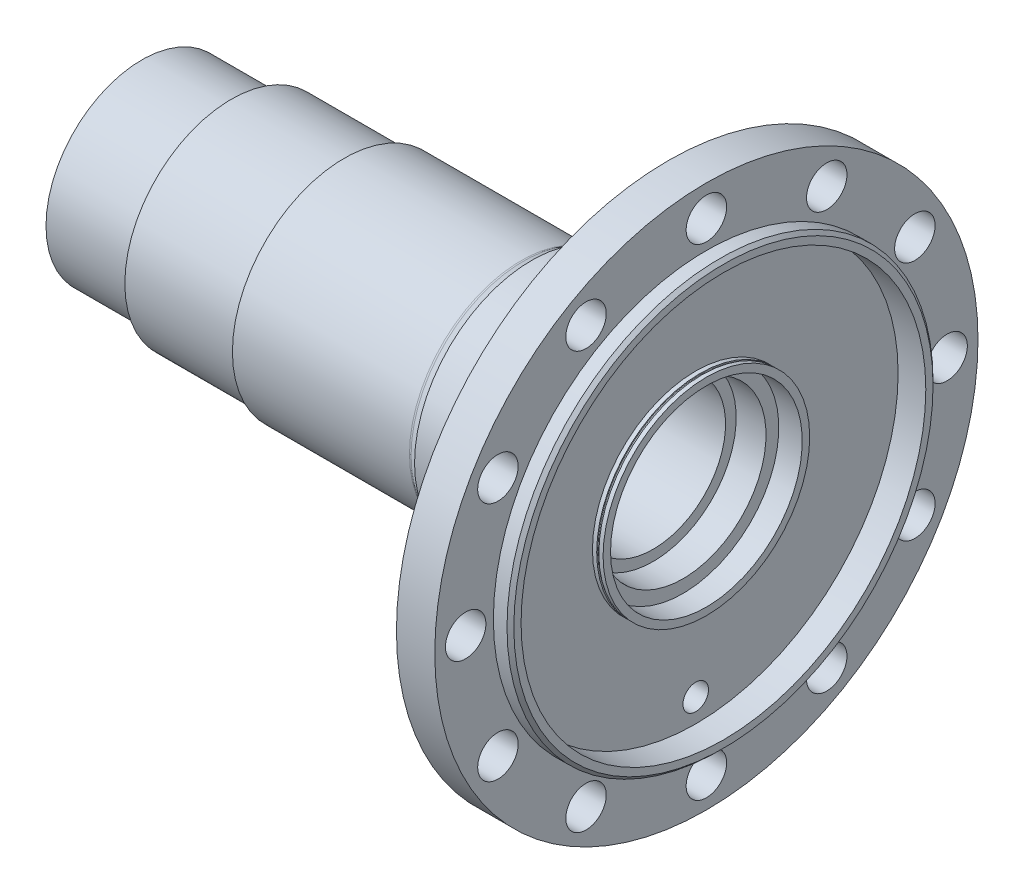
from build123d import *

# Parameters (mm, degrees)
SKETCH_3_W           = 2
SKETCH_3_H           = 46.5
SKETCH_5_W           = 2
SKETCH_5_H           = 46.5
SKETCH_6_R           = 9.5
CUT_EXTRUDE_1_DEPTH  = 328.171973127
SKETCH_7_R           = 9.5
CUT_EXTRUDE_2_DEPTH  = 328.171973127
SKETCH_8_R           = 9.5
CUT_EXTRUDE_3_DEPTH  = 328.171973127
SKETCH_9_R           = 9.5
CUT_EXTRUDE_4_DEPTH  = 328.171973127
SKETCH_10_R          = 9.5
CUT_EXTRUDE_5_DEPTH  = 328.171973127
SKETCH_11_R          = 9.5
CUT_EXTRUDE_6_DEPTH  = 328.171973127
SKETCH_12_R          = 9.5
CUT_EXTRUDE_7_DEPTH  = 328.171973127
SKETCH_13_R          = 9.5
CUT_EXTRUDE_8_DEPTH  = 328.171973127
SKETCH_14_R          = 9.5
CUT_EXTRUDE_9_DEPTH  = 328.171973127
SKETCH_15_R          = 9.5
CUT_EXTRUDE_10_DEPTH = 328.171973127
SKETCH_16_R          = 9.5
CUT_EXTRUDE_11_DEPTH = 328.171973127
SKETCH_17_R          = 9.5
CUT_EXTRUDE_12_DEPTH = 328.171973127
SKETCH_18_R          = 6
CUT_EXTRUDE_13_DEPTH = 328.171973127


with BuildPart() as part:
    # Эскиз1 → Повернуть1 (revolve)
    with BuildSketch(Plane.XY, mode=Mode.PRIVATE) as revolve_1_sk:
        with BuildLine():
            Line((0, 0), (273, 0))
            Line((273, 0), (273, 98.4))
            Line((273, 98.4), (271.4, 100))
            Line((271.4, 100), (265, 100))
            Line((265, 100), (265, 127.5))
            Line((265, 127.5), (247, 127.5))
            Line((247, 127.5), (247, 100))
            Line((247, 100), (239, 100))
            Line((239, 100), (239, 64.5))
            ThreePointArc((239, 64.5), (238.414213562, 63.085786438), (237, 62.5))
            Line((237, 62.5), (218, 62.5))
            Line((218, 62.5), (215, 60.767949192))
            Line((215, 60.767949192), (215, 57))
            ThreePointArc((215, 57), (214.414213562, 55.585786438), (213, 55))
            Line((213, 55), (183, 55))
            Line((183, 55), (179.133974596, 52.767949192))
            ThreePointArc((179.133974596, 52.767949192), (178.651612686, 52.568148347), (178.133974596, 52.5))
            Line((178.133974596, 52.5), (95, 52.5))
            Line((95, 52.5), (95, 50))
            Line((95, 50), (42, 50))
            Line((42, 50), (42, 45))
            Line((42, 45), (0, 45))
            Line((0, 45), (0, 0))
        make_face()
    revolve(revolve_1_sk.sketch.rotate(Axis((0, 0, 0), (1, 0, 0)), 90), axis=Axis((0, 0, 0), (1, 0, 0)))

    # Эскиз2 → Вырез-Повернуть1 (revolve, cut)
    with BuildSketch(Plane.XY, mode=Mode.PRIVATE) as cut_revolve_1_sk:
        Polygon((0, 0), (273, 0), (273, 95), (265, 95), (265, 45), (254, 45), (254, 39), (240, 39), (240, 34), (203.5, 34), (203.5, 31), (0, 31), align=None)
    revolve(cut_revolve_1_sk.sketch.rotate(Axis((0, 0, 0), (1, 0, 0)), 90), axis=Axis((0, 0, 0), (1, 0, 0)), mode=Mode.SUBTRACT)

    # Эскиз3 → Rear_recess_left (revolve, cut)
    with BuildSketch(Plane.XY, mode=Mode.PRIVATE) as rear_recess_left_sk:
        with Locations((261, 71.75)):
            Rectangle(SKETCH_3_W, SKETCH_3_H)
    revolve(rear_recess_left_sk.sketch.rotate(Axis((0, 0, 0), (1, 0, 0)), 90), axis=Axis((0, 0, 0), (1, 0, 0)), mode=Mode.SUBTRACT)

    # Эскиз4 → Collar_groove_nominal (revolve, cut)
    with BuildSketch(Plane.XY, mode=Mode.PRIVATE) as collar_groove_nominal_sk:
        with BuildLine():
            Line((263, 48), (263, 95))
            Line((263, 95), (262, 95))
            Line((262, 95), (262, 48))
            ThreePointArc((262, 48), (262.146446609, 47.646446609), (262.5, 47.5))
            ThreePointArc((262.5, 47.5), (262.853553391, 47.646446609), (263, 48))
        make_face()
    revolve(collar_groove_nominal_sk.sketch.rotate(Axis((0, 0, 0), (1, 0, 0)), 90), axis=Axis((0, 0, 0), (1, 0, 0)), mode=Mode.SUBTRACT)

    # Эскиз5 → Rear_recess_lip (revolve, cut)
    with BuildSketch(Plane.XY, mode=Mode.PRIVATE) as rear_recess_lip_sk:
        with Locations((264, 71.75)):
            Rectangle(SKETCH_5_W, SKETCH_5_H)
    revolve(rear_recess_lip_sk.sketch.rotate(Axis((0, 0, 0), (1, 0, 0)), 90), axis=Axis((0, 0, 0), (1, 0, 0)), mode=Mode.SUBTRACT)

    # Эскиз6 → Вырез-Вытянуть1 (cut, through all)
    with BuildSketch(Plane(origin=(0, 0, 0), x_dir=(0, 0, -1), z_dir=(1, 0, 0))):
        with Locations(Location((0, 113, 0), (0, 0, 180))):
            Circle(SKETCH_6_R)
    extrude(amount=CUT_EXTRUDE_1_DEPTH, mode=Mode.SUBTRACT)

    # Эскиз7 → Вырез-Вытянуть2 (cut, through all)
    with BuildSketch(Plane(origin=(0, 0, 0), x_dir=(0, 0, -1), z_dir=(1, 0, 0))):
        with Locations(Location((-56.5, 97.860870628, 0), (0, 0, 180))):
            Circle(SKETCH_7_R)
    extrude(amount=CUT_EXTRUDE_2_DEPTH, mode=Mode.SUBTRACT)

    # Эскиз8 → Вырез-Вытянуть3 (cut, through all)
    with BuildSketch(Plane(origin=(0, 0, 0), x_dir=(0, 0, -1), z_dir=(1, 0, 0))):
        with Locations(Location((-97.860870628, 56.5, 0), (0, 0, 180))):
            Circle(SKETCH_8_R)
    extrude(amount=CUT_EXTRUDE_3_DEPTH, mode=Mode.SUBTRACT)

    # Эскиз9 → Вырез-Вытянуть4 (cut, through all)
    with BuildSketch(Plane(origin=(0, 0, 0), x_dir=(0, 0, -1), z_dir=(1, 0, 0))):
        with Locations(Location((-113, 0, 0), (0, 0, 180))):
            Circle(SKETCH_9_R)
    extrude(amount=CUT_EXTRUDE_4_DEPTH, mode=Mode.SUBTRACT)

    # Эскиз10 → Вырез-Вытянуть5 (cut, through all)
    with BuildSketch(Plane(origin=(0, 0, 0), x_dir=(0, 0, -1), z_dir=(1, 0, 0))):
        with Locations(Location((-97.860870628, -56.5, 0), (0, 0, 180))):
            Circle(SKETCH_10_R)
    extrude(amount=CUT_EXTRUDE_5_DEPTH, mode=Mode.SUBTRACT)

    # Эскиз11 → Вырез-Вытянуть6 (cut, through all)
    with BuildSketch(Plane(origin=(0, 0, 0), x_dir=(0, 0, -1), z_dir=(1, 0, 0))):
        with Locations(Location((-56.5, -97.860870628, 0), (0, 0, 180))):
            Circle(SKETCH_11_R)
    extrude(amount=CUT_EXTRUDE_6_DEPTH, mode=Mode.SUBTRACT)

    # Эскиз12 → Вырез-Вытянуть7 (cut, through all)
    with BuildSketch(Plane(origin=(0, 0, 0), x_dir=(0, 0, -1), z_dir=(1, 0, 0))):
        with Locations(Location((0, -113, 0), (0, 0, 180))):
            Circle(SKETCH_12_R)
    extrude(amount=CUT_EXTRUDE_7_DEPTH, mode=Mode.SUBTRACT)

    # Эскиз13 → Вырез-Вытянуть8 (cut, through all)
    with BuildSketch(Plane(origin=(0, 0, 0), x_dir=(0, 0, -1), z_dir=(1, 0, 0))):
        with Locations(Location((56.5, -97.860870628, 0), (0, 0, 180))):
            Circle(SKETCH_13_R)
    extrude(amount=CUT_EXTRUDE_8_DEPTH, mode=Mode.SUBTRACT)

    # Эскиз14 → Вырез-Вытянуть9 (cut, through all)
    with BuildSketch(Plane(origin=(0, 0, 0), x_dir=(0, 0, -1), z_dir=(1, 0, 0))):
        with Locations(Location((97.860870628, -56.5, 0), (0, 0, 180))):
            Circle(SKETCH_14_R)
    extrude(amount=CUT_EXTRUDE_9_DEPTH, mode=Mode.SUBTRACT)

    # Эскиз15 → Вырез-Вытянуть10 (cut, through all)
    with BuildSketch(Plane(origin=(0, 0, 0), x_dir=(0, 0, -1), z_dir=(1, 0, 0))):
        with Locations(Location((113, 0, 0), (0, 0, 180))):
            Circle(SKETCH_15_R)
    extrude(amount=CUT_EXTRUDE_10_DEPTH, mode=Mode.SUBTRACT)

    # Эскиз16 → Вырез-Вытянуть11 (cut, through all)
    with BuildSketch(Plane(origin=(0, 0, 0), x_dir=(0, 0, -1), z_dir=(1, 0, 0))):
        with Locations(Location((97.860870628, 56.5, 0), (0, 0, 180))):
            Circle(SKETCH_16_R)
    extrude(amount=CUT_EXTRUDE_11_DEPTH, mode=Mode.SUBTRACT)

    # Эскиз17 → Вырез-Вытянуть12 (cut, through all)
    with BuildSketch(Plane(origin=(0, 0, 0), x_dir=(0, 0, -1), z_dir=(1, 0, 0))):
        with Locations(Location((56.5, 97.860870628, 0), (0, 0, 180))):
            Circle(SKETCH_17_R)
    extrude(amount=CUT_EXTRUDE_12_DEPTH, mode=Mode.SUBTRACT)

    # Эскиз18 → Вырез-Вытянуть13 (cut, through all)
    with BuildSketch(Plane(origin=(0, 0, 0), x_dir=(0, 0, -1), z_dir=(1, 0, 0))):
        with Locations((0, -84)):
            Circle(SKETCH_18_R)
    extrude(amount=CUT_EXTRUDE_13_DEPTH, mode=Mode.SUBTRACT)


solid = part.part
